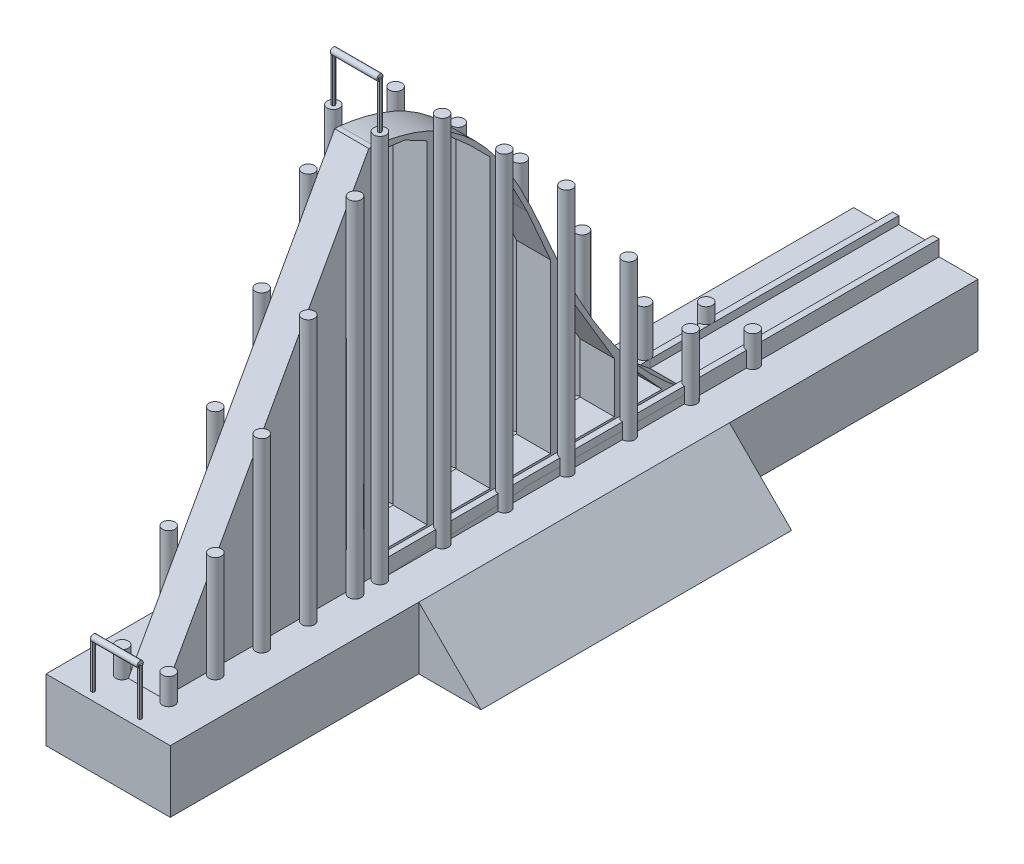
from build123d import *

# Parameters (mm, degrees)
SKETCH4_W              = 101.6
SKETCH4_H              = 50.8
BOSS_EXTRUDE2_DEPTH    = 660.4
SKETCH11_R             = 5.08
BOSS_EXTRUDE4_DEPTH    = 317.5
SKETCH13_R             = 5.08
BOSS_EXTRUDE5_DEPTH    = 281.94
SKETCH14_R             = 5.08
BOSS_EXTRUDE6_DEPTH    = 216.916
SKETCH15_R             = 5.08
BOSS_EXTRUDE7_DEPTH    = 151.7904
SKETCH16_R             = 5.08
BOSS_EXTRUDE8_DEPTH    = 86.5886
SKETCH17_R             = 5.08
BOSS_EXTRUDE9_DEPTH    = 21.39188
SKETCH27_W             = 27.94
SKETCH27_H             = 172.72
EXTRUDE_THIN8_DEPTH    = 304.8
SKETCH30_W             = 38.1
SKETCH30_H             = 203.2
BOSS_EXTRUDE20_DEPTH   = 12.7
CUT_EXTRUDE5_DEPTH     = 6.35
BOSS_EXTRUDE22_DEPTH   = 27.94
SKETCH33_W             = 38.1
SKETCH33_H             = 254
BOSS_EXTRUDE25_DEPTH   = 6.35
SKETCH35_W             = 248.92
SKETCH35_H             = 12.7
BOSS_EXTRUDE28_DEPTH   = 5.08
BOSS_EXTRUDE29_DEPTH   = 5.08
SKETCH37_R             = 5.08
BOSS_EXTRUDE31_DEPTH   = 304.8
BOSS_EXTRUDE31_2_DEPTH = 304.8
CUT_EXTRUDE6_DEPTH     = 27.94
SKETCH40_R             = 5.08
BOSS_EXTRUDE32_DEPTH   = 254
BOSS_EXTRUDE32_2_DEPTH = 254
SKETCH41_R             = 5.08
BOSS_EXTRUDE34_DEPTH   = 203.2
BOSS_EXTRUDE34_2_DEPTH = 203.2
SKETCH42_R             = 5.08
BOSS_EXTRUDE36_DEPTH   = 127
BOSS_EXTRUDE36_2_DEPTH = 127
SKETCH43_R             = 5.08
BOSS_EXTRUDE37_DEPTH   = 50.8
BOSS_EXTRUDE37_2_DEPTH = 50.8
SKETCH44_R             = 5.08
BOSS_EXTRUDE38_DEPTH   = 25.4
CUT_EXTRUDE7_DEPTH     = 27.94
CUT_EXTRUDE9_DEPTH     = 27.94
CUT_EXTRUDE10_DEPTH    = 27.94
CUT_EXTRUDE11_DEPTH    = 27.94
CUT_EXTRUDE12_DEPTH    = 27.94
BOSS_EXTRUDE39_DEPTH   = 660.4
CUT_EXTRUDE13_DEPTH    = 203.2
CUT_EXTRUDE14_DEPTH    = 203.2
BOSS_EXTRUDE40_DEPTH   = 38.1
SKETCH56_W             = 38.1
SKETCH56_H             = 2.54
BOSS_EXTRUDE41_DEPTH   = 38.1
SKETCH58_W             = 38.1
SKETCH58_H             = 2.54


with BuildPart() as part:
    # Sketch4 → Boss-Extrude2 (new body)
    with BuildSketch(Plane.XY):
        with Locations((50.8, 25.4)):
            Rectangle(SKETCH4_W, SKETCH4_H)
    extrude(amount=BOSS_EXTRUDE2_DEPTH)

    # Sketch11 → Boss-Extrude4 (add)
    with BuildSketch(Plane(origin=(0, 50.8, 0), x_dir=(1, 0, 0), z_dir=(0, 1, 0))):
        with Locations(Location((69.85, -457.2, 0), (0, 0, 90))):
            Circle(SKETCH11_R)
        with Locations(Location((31.75, -457.2, 0), (0, 0, 90))):
            Circle(SKETCH11_R)
    extrude(amount=BOSS_EXTRUDE4_DEPTH)

    # Sketch13 → Boss-Extrude5 (add)
    with BuildSketch(Plane(origin=(0, 50.8, 0), x_dir=(1, 0, 0), z_dir=(0, 1, 0))):
        with Locations(Location((31.75, -477.605690353, 0), (0, 0, 90))):
            Circle(SKETCH13_R)
        with Locations(Location((69.85, -477.605690353, 0), (0, 0, 90))):
            Circle(SKETCH13_R)
    extrude(amount=BOSS_EXTRUDE5_DEPTH)

    # Sketch14 → Boss-Extrude6 (add)
    with BuildSketch(Plane(origin=(0, 50.8, 0), x_dir=(1, 0, 0), z_dir=(0, 1, 0))):
        with Locations(Location((31.75, -515.814980038, 0), (0, 0, 90))):
            Circle(SKETCH14_R)
        with Locations(Location((69.85, -515.814980038, 0), (0, 0, 90))):
            Circle(SKETCH14_R)
    extrude(amount=BOSS_EXTRUDE6_DEPTH)

    # Sketch15 → Boss-Extrude7 (add)
    with BuildSketch(Plane(origin=(0, 50.8, 0), x_dir=(1, 0, 0), z_dir=(0, 1, 0))):
        with Locations(Location((31.75, -553.825889709, 0), (0, 0, 90))):
            Circle(SKETCH15_R)
        with Locations(Location((69.85, -553.825889709, 0), (0, 0, 90))):
            Circle(SKETCH15_R)
    extrude(amount=BOSS_EXTRUDE7_DEPTH)

    # Sketch16 → Boss-Extrude8 (add)
    with BuildSketch(Plane(origin=(0, 50.8, 0), x_dir=(1, 0, 0), z_dir=(0, 1, 0))):
        with Locations(Location((31.75, -591.82, 0), (0, 0, 90))):
            Circle(SKETCH16_R)
        with Locations(Location((69.85, -591.82, 0), (0, 0, 90))):
            Circle(SKETCH16_R)
    extrude(amount=BOSS_EXTRUDE8_DEPTH)

    # Sketch17 → Boss-Extrude9 (add)
    with BuildSketch(Plane(origin=(0, 50.8, 0), x_dir=(1, 0, 0), z_dir=(0, 1, 0))):
        with Locations(Location((31.75, -629.92, 0), (0, 0, 90))):
            Circle(SKETCH17_R)
        with Locations(Location((69.85, -629.92, 0), (0, 0, 90))):
            Circle(SKETCH17_R)
    extrude(amount=BOSS_EXTRUDE9_DEPTH)

    # Sketch30 → Boss-Extrude20 (add)
    with BuildSketch(Plane(origin=(0, 50.8, 0), x_dir=(1, 0, 0), z_dir=(0, 1, 0))):
        with Locations((50.8, -101.6)):
            Rectangle(SKETCH30_W, SKETCH30_H)
    extrude(amount=BOSS_EXTRUDE20_DEPTH)

    # Sketch31 → Cut-Extrude5 (cut)
    with BuildSketch(Plane(origin=(0, 63.5, 0), x_dir=(1, 0, 0), z_dir=(0, 1, 0))):
        Polygon((50.8, -203.2), (64.77, -203.2), (64.77, 0), (36.83, 0), (36.83, -203.2), align=None)
    extrude(amount=-CUT_EXTRUDE5_DEPTH, mode=Mode.SUBTRACT)

    # Sketch44 → Boss-Extrude38 (add)
    with BuildSketch(Plane(origin=(0, 50.8, 0), x_dir=(1, 0, 0), z_dir=(0, 1, 0))):
        with Locations(Location((69.85, -152.394398331, 0), (0, 0, 270))):
            Circle(SKETCH44_R)
        with Locations(Location((31.75, -152.394398331, 0), (0, 0, 270))):
            Circle(SKETCH44_R)
    extrude(amount=BOSS_EXTRUDE38_DEPTH)

    # Sketch51 → Boss-Extrude39 (add)
    with BuildSketch(Plane.XY.offset(660.4)):
        Polygon((101.6, 50.8), (152.4, 0), (101.6, 0), align=None)
    extrude(amount=-BOSS_EXTRUDE39_DEPTH)

    # Sketch52 → Cut-Extrude13 (cut)
    with BuildSketch(Plane.XY.offset(660.4)):
        Polygon((101.6, 50.8), (101.6, 0), (152.4, 0), align=None)
    extrude(amount=-CUT_EXTRUDE13_DEPTH, mode=Mode.SUBTRACT)

    # Sketch53 → Cut-Extrude14 (cut)
    with BuildSketch(Plane(origin=(0, 0, 0), x_dir=(-1, 0, 0), z_dir=(0, 0, -1))):
        Polygon((-101.6, 50.8), (-152.4, 0), (-101.6, 0), align=None)
    extrude(amount=-CUT_EXTRUDE14_DEPTH, mode=Mode.SUBTRACT)

    # Sketch55 → Boss-Extrude40 (add)
    with BuildSketch(Plane(origin=(0, 368.3, 0), x_dir=(1, 0, 0), z_dir=(0, 1, 0))):
        Polygon((70.789482088, -458.32601365), (71.29489747, -456.94939147), (70.355415381, -455.82337782), (68.910517912, -456.07398635), (68.40510253, -457.45060853), (69.344584619, -458.57662218), align=None)
        Polygon((33.216469684, -457.2), (32.483234842, -455.93), (31.016765158, -455.93), (30.283530316, -457.2), (31.016765158, -458.47), (32.483234842, -458.47), align=None)
    extrude(amount=BOSS_EXTRUDE40_DEPTH)

    # Sketch56 → Revolve-Thin2 (revolve)
    with BuildSketch(Plane(origin=(0, 406.4, 0), x_dir=(1, 0, 0), z_dir=(0, 1, 0)), mode=Mode.PRIVATE) as revolve_thin2_sk:
        with Locations((50.8, -458.47)):
            Rectangle(SKETCH56_W, SKETCH56_H)
    revolve(revolve_thin2_sk.sketch.rotate(Axis((69.85, 406.4, 457.2), (-1, 0, 0)), 239.504880717), axis=Axis((69.85, 406.4, 457.2), (-1, 0, 0)))

    # Sketch57 → Boss-Extrude41 (add)
    with BuildSketch(Plane(origin=(0, 50.8, 0), x_dir=(1, 0, 0), z_dir=(0, 1, 0))):
        Polygon((71.316469684, -653.236147929), (70.583234842, -651.966147929), (69.116765158, -651.966147929), (68.383530316, -653.236147929), (69.116765158, -654.506147929), (70.583234842, -654.506147929), align=None)
        Polygon((32.787386554, -653.236147929), (32.054151712, -651.966147929), (30.587682028, -651.966147929), (29.854447186, -653.236147929), (30.587682028, -654.506147929), (32.054151712, -654.506147929), align=None)
    extrude(amount=BOSS_EXTRUDE41_DEPTH)


with BuildPart() as body_2:
    # Sketch27 → Extrude-Thin8 (new body)
    with BuildSketch(Plane(origin=(0, 50.8, 0), x_dir=(1, 0, 0), z_dir=(0, 1, 0))):
        with Locations((50.8, -543.56)):
            Rectangle(SKETCH27_W, SKETCH27_H)
    extrude(amount=EXTRUDE_THIN8_DEPTH)

    # Sketch38 → Cut-Extrude6 (cut)
    with BuildSketch(Plane(origin=(64.77, 0, 0), x_dir=(0, 0, -1), z_dir=(1, 0, 0))):
        Polygon((-461.194409547, 355.6), (-629.92, 50.8), (-629.92, 355.6), align=None)
    extrude(amount=-CUT_EXTRUDE6_DEPTH, mode=Mode.SUBTRACT)


with BuildPart() as body_3:
    # Sketch32 → Boss-Extrude22 (new body)
    with BuildSketch(Plane(origin=(64.77, 0, 0), x_dir=(0, 0, -1), z_dir=(1, 0, 0))):
        with BuildLine():
            Line((-204.146747954, 57.593771606), (-457.2, 57.593771606))
            Line((-457.2, 57.593771606), (-457.2, 355.6))
            add(Edge.make_bspline(
                [(-457.2, 355.6), (-355.238544006, 343.548652424), (-321.909039404, 201.552102845), (-246.087286314, 89.314090161), (-204.146747954, 57.593771606)],
                knots=[0, 0, 0, 0, 0.612594489, 1, 1, 1, 1], degree=3))
        make_face()
    extrude(amount=-BOSS_EXTRUDE22_DEPTH)

    # Sketch45 → Cut-Extrude7 (cut)
    with BuildSketch(Plane.ZY.offset(-36.83)):
        Polygon((247.077862511, 65.2454043), (247.077862511, 93.635552955), (221.519968916, 65.2454043), align=None)
    extrude(amount=-CUT_EXTRUDE7_DEPTH, mode=Mode.SUBTRACT)

    # Sketch46 → Cut-Extrude9 (cut)
    with BuildSketch(Plane.ZY.offset(-36.83)):
        Polygon((264.325592381, 65.2454043), (297.923655529, 65.2454043), (297.923655529, 169.504483935), (264.325592381, 112.984572322), (260.438753217, 106.445986897), (260.438753217, 65.2454043), align=None)
    extrude(amount=-CUT_EXTRUDE9_DEPTH, mode=Mode.SUBTRACT)

    # Sketch47 → Cut-Extrude10 (cut)
    with BuildSketch(Plane.ZY.offset(-36.83)):
        Polygon((312.684169029, 65.2454043), (348.207514412, 65.2454043), (348.207514412, 253.255753437), (348.207514412, 278.217517724), (331.832653282, 246.412150224), (312.684169029, 202.508105558), align=None)
    extrude(amount=-CUT_EXTRUDE10_DEPTH, mode=Mode.SUBTRACT)

    # Sketch48 → Cut-Extrude11 (cut)
    with BuildSketch(Plane.ZY.offset(-36.83)):
        Polygon((362.013977394, 65.2454043), (398.50028477, 65.2454043), (398.50028477, 304.417048139), (398.50028477, 334.143160243), (378.975110382, 316.971607097), (362.013977394, 300.010474109), align=None)
    extrude(amount=-CUT_EXTRUDE11_DEPTH, mode=Mode.SUBTRACT)

    # Sketch49 → Cut-Extrude12 (cut)
    with BuildSketch(Plane.ZY.offset(-36.83)):
        Polygon((413.464598827, 65.2454043), (449.566278927, 65.2454043), (449.566278927, 337.174247116), (449.566278927, 349.225207382), (431.861192586, 346.875419697), (413.464598827, 337.174247116), align=None)
    extrude(amount=-CUT_EXTRUDE12_DEPTH, mode=Mode.SUBTRACT)


with BuildPart() as body_4:
    # Sketch33 → Boss-Extrude25 (new body)
    with BuildSketch(Plane(origin=(0, 50.8, 0), x_dir=(1, 0, 0), z_dir=(0, 1, 0))):
        with Locations((50.8, -330.2)):
            Rectangle(SKETCH33_W, SKETCH33_H)
    extrude(amount=BOSS_EXTRUDE25_DEPTH)


with BuildPart() as body_5:
    # Sketch35 → Boss-Extrude28 (new body)
    with BuildSketch(Plane(origin=(69.85, 0, 0), x_dir=(0, 0, -1), z_dir=(1, 0, 0))):
        with Locations((-327.66, 57.15)):
            Rectangle(SKETCH35_W, SKETCH35_H)
    extrude(amount=-BOSS_EXTRUDE28_DEPTH)


with BuildPart() as body_6:
    # Sketch36 → Boss-Extrude29 (new body)
    with BuildSketch(Plane.ZY.offset(-31.75)):
        Polygon((203.2, 63.5), (203.2, 57.15), (452.055338889, 57.15), (452.12, 63.5), align=None)
    extrude(amount=-BOSS_EXTRUDE29_DEPTH)


with BuildPart() as body_7:
    # Sketch37 → Boss-Extrude31 (new body)
    with BuildSketch(Plane(origin=(0, 50.8, 0), x_dir=(1, 0, 0), z_dir=(0, 1, 0))):
        with Locations(Location((69.85, -406.349972603, 0), (0, 0, 90))):
            Circle(SKETCH37_R)
    extrude(amount=BOSS_EXTRUDE31_DEPTH)


with BuildPart() as body_8:
    # Sketch37 → Boss-Extrude31 2 (new body)
    with BuildSketch(Plane(origin=(0, 50.8, 0), x_dir=(1, 0, 0), z_dir=(0, 1, 0))):
        with Locations(Location((31.75, -406.349972603, 0), (0, 0, 90))):
            Circle(SKETCH37_R)
    extrude(amount=BOSS_EXTRUDE31_2_DEPTH)


with BuildPart() as body_9:
    # Sketch40 → Boss-Extrude32 (new body)
    with BuildSketch(Plane(origin=(0, 50.8, 0), x_dir=(1, 0, 0), z_dir=(0, 1, 0))):
        with Locations(Location((69.85, -355.449822756, 0), (0, 0, 270))):
            Circle(SKETCH40_R)
    extrude(amount=BOSS_EXTRUDE32_DEPTH)


with BuildPart() as body_10:
    # Sketch40 → Boss-Extrude32 2 (new body)
    with BuildSketch(Plane(origin=(0, 50.8, 0), x_dir=(1, 0, 0), z_dir=(0, 1, 0))):
        with Locations(Location((31.75, -355.449822756, 0), (0, 0, 270))):
            Circle(SKETCH40_R)
    extrude(amount=BOSS_EXTRUDE32_2_DEPTH)


with BuildPart() as body_11:
    # Sketch41 → Boss-Extrude34 (new body)
    with BuildSketch(Plane(origin=(0, 50.8, 0), x_dir=(1, 0, 0), z_dir=(0, 1, 0))):
        with Locations(Location((69.85, -304.742199179, 0), (0, 0, 270))):
            Circle(SKETCH41_R)
    extrude(amount=BOSS_EXTRUDE34_DEPTH)


with BuildPart() as body_12:
    # Sketch41 → Boss-Extrude34 2 (new body)
    with BuildSketch(Plane(origin=(0, 50.8, 0), x_dir=(1, 0, 0), z_dir=(0, 1, 0))):
        with Locations(Location((31.75, -304.742199179, 0), (0, 0, 270))):
            Circle(SKETCH41_R)
    extrude(amount=BOSS_EXTRUDE34_2_DEPTH)


with BuildPart() as body_13:
    # Sketch42 → Boss-Extrude36 (new body)
    with BuildSketch(Plane(origin=(0, 50.8, 0), x_dir=(1, 0, 0), z_dir=(0, 1, 0))):
        with Locations(Location((69.85, -253.913746307, 0), (0, 0, 270))):
            Circle(SKETCH42_R)
    extrude(amount=BOSS_EXTRUDE36_DEPTH)


with BuildPart() as body_14:
    # Sketch42 → Boss-Extrude36 2 (new body)
    with BuildSketch(Plane(origin=(0, 50.8, 0), x_dir=(1, 0, 0), z_dir=(0, 1, 0))):
        with Locations(Location((31.75, -253.913746307, 0), (0, 0, 270))):
            Circle(SKETCH42_R)
    extrude(amount=BOSS_EXTRUDE36_2_DEPTH)


with BuildPart() as body_15:
    # Sketch43 → Boss-Extrude37 (new body)
    with BuildSketch(Plane(origin=(0, 50.8, 0), x_dir=(1, 0, 0), z_dir=(0, 1, 0))):
        with Locations(Location((69.85, -203.2, 0), (0, 0, 270))):
            Circle(SKETCH43_R)
    extrude(amount=BOSS_EXTRUDE37_DEPTH)


with BuildPart() as body_16:
    # Sketch43 → Boss-Extrude37 2 (new body)
    with BuildSketch(Plane(origin=(0, 50.8, 0), x_dir=(1, 0, 0), z_dir=(0, 1, 0))):
        with Locations(Location((31.75, -203.2, 0), (0, 0, 270))):
            Circle(SKETCH43_R)
    extrude(amount=BOSS_EXTRUDE37_2_DEPTH)


with BuildPart() as body_17:
    # Sketch58 → Revolve-Thin3 (revolve)
    with BuildSketch(Plane(origin=(0, 88.9, 0), x_dir=(1, 0, 0), z_dir=(0, 1, 0)), mode=Mode.PRIVATE) as revolve_thin3_sk:
        with Locations((50.8, -654.532064366)):
            Rectangle(SKETCH58_W, SKETCH58_H)
    revolve(revolve_thin3_sk.sketch.rotate(Axis((69.85, 88.9, 653.262064366), (-1, 0, 0)), 180), axis=Axis((69.85, 88.9, 653.262064366), (-1, 0, 0)))


solid = Compound([part.part, body_2.part, body_3.part, body_4.part, body_5.part, body_6.part, body_7.part, body_8.part, body_9.part, body_10.part, body_11.part, body_12.part, body_13.part, body_14.part, body_15.part, body_16.part, body_17.part])
